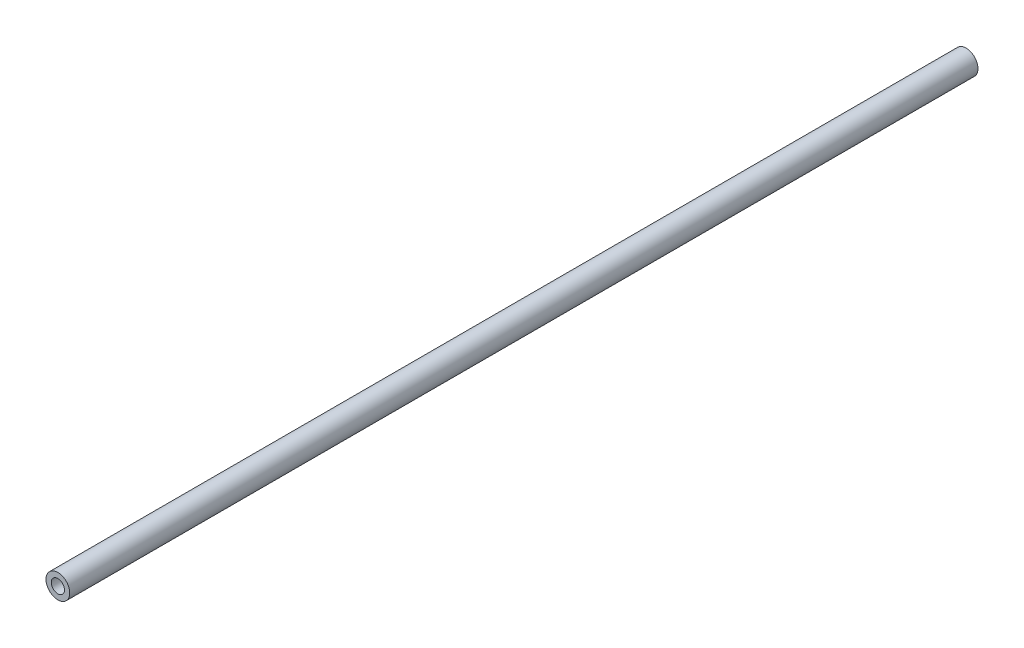
from build123d import *

# Parameters (mm, degrees)
SKETCH32_R          = 8.55
SKETCH32_R_2        = 4.765
BOSS_EXTRUDE1_DEPTH = 653.17


with BuildPart() as part:
    # Sketch32 → Boss-Extrude1 (new body)
    with BuildSketch(Plane.XY):
        Circle(SKETCH32_R)
        Circle(SKETCH32_R_2, mode=Mode.SUBTRACT)
    extrude(amount=BOSS_EXTRUDE1_DEPTH)


solid = part.part
